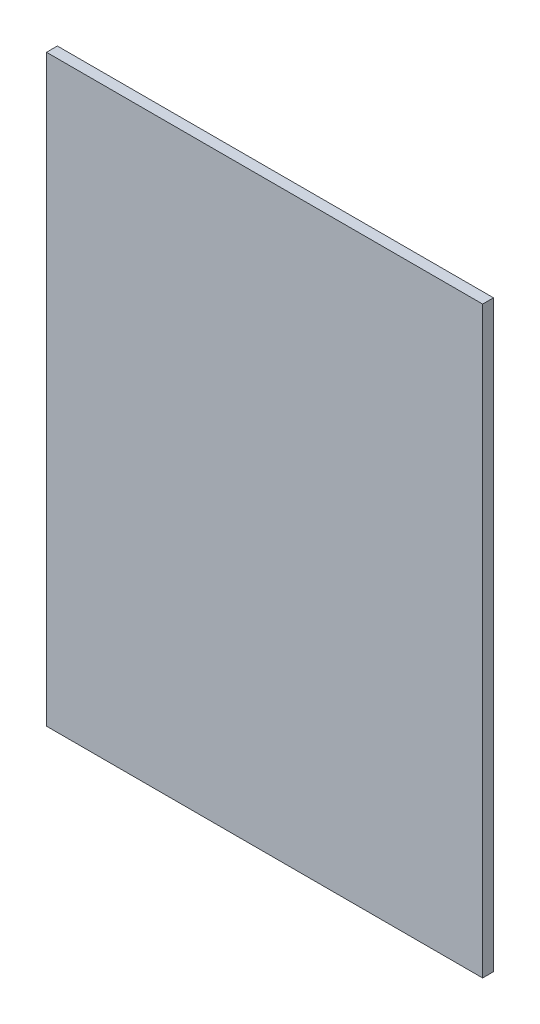
from build123d import *

# Parameters (mm, degrees)
SKETCH1_W           = 510.54
SKETCH1_H           = 683.26
BOSS_EXTRUDE1_DEPTH = 12.7


with BuildPart() as part:
    # Sketch1 → Boss-Extrude1 (new body)
    with BuildSketch(Plane.XY):
        with Locations((255.27, 341.63)):
            Rectangle(SKETCH1_W, SKETCH1_H)
    extrude(amount=BOSS_EXTRUDE1_DEPTH)


solid = part.part
